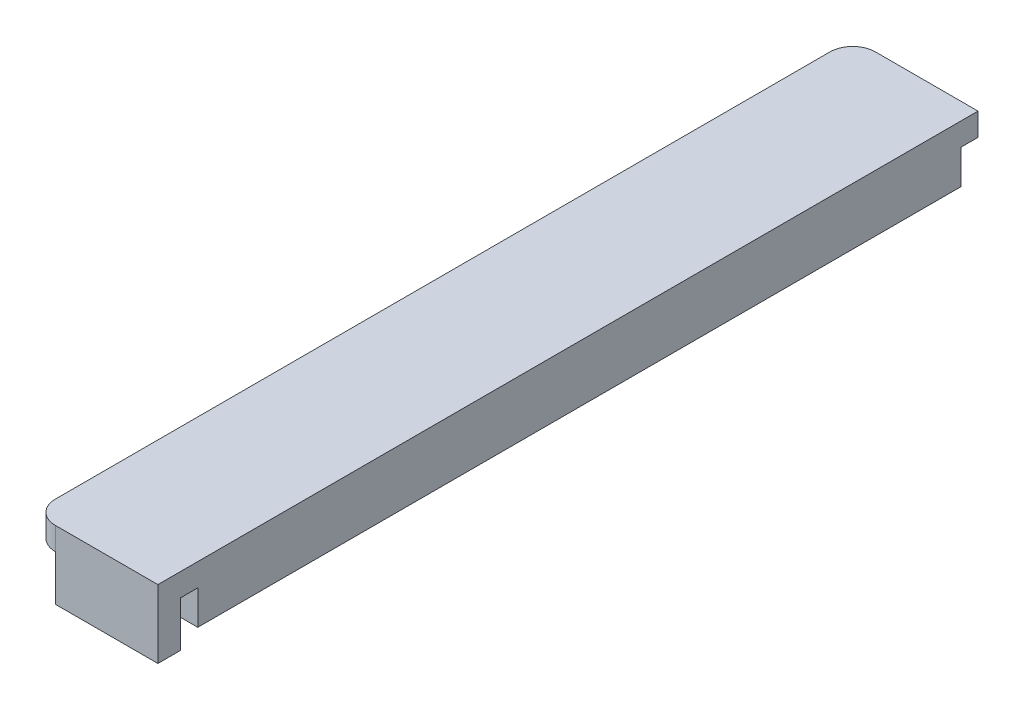
from build123d import *

# Parameters (mm, degrees)
EXTRUDE_1_DEPTH     = 2
SKETCH_2_W          = 9
SKETCH_2_H          = 2
EXTRUDE_2_DEPTH     = 4
SKETCH_3_W          = 9.5
SKETCH_3_H          = 67
EXTRUDE_3_DEPTH     = 3
SKETCH_4_W          = 16.00447387
SKETCH_4_H          = 2
CUT_EXTRUDE_1_DEPTH = 10
FILLET_1_R          = 2


with BuildPart() as part:
    # 草图1 → 凸台-拉伸1 (new body)
    with BuildSketch(Plane(origin=(0, 0, 0), x_dir=(1, 0, 0), z_dir=(0, 1, 0))):
        with BuildLine():
            Line((-3.5, 37), (5.5, 37))
            Line((5.5, 37), (5.5, -37))
            Line((5.5, -37), (-3.5, -37))
            ThreePointArc((-3.5, -37), (-4.914213562, -36.414213562), (-5.5, -35))
            Line((-5.5, -35), (-5.5, 35))
            ThreePointArc((-5.5, 35), (-4.914213562, 36.414213562), (-3.5, 37))
        make_face()
    extrude(amount=EXTRUDE_1_DEPTH)

    # 草图2 → 凸台-拉伸2 (add)
    with BuildSketch(Plane.XZ):
        with Locations((1, 36)):
            Rectangle(SKETCH_2_W, SKETCH_2_H)
        with Locations((1, -36)):
            Rectangle(SKETCH_2_W, SKETCH_2_H)
    extrude(amount=EXTRUDE_2_DEPTH)

    # 草图3 → 凸台-拉伸3 (add)
    with BuildSketch(Plane.XZ):
        with Locations((0.75, 0)):
            Rectangle(SKETCH_3_W, SKETCH_3_H)
    extrude(amount=EXTRUDE_3_DEPTH)

    # 草图4 → 切除-拉伸1 (cut)
    with BuildSketch(Plane.XZ.offset(4)):
        with Locations((-2.502236935, -36)):
            Rectangle(SKETCH_4_W, SKETCH_4_H)
    extrude(amount=-CUT_EXTRUDE_1_DEPTH, mode=Mode.SUBTRACT)

    # 圆角1
    fillet_1_edges = [part.edges().sort_by_distance(p)[0] for p in [
        (-5.5, 1, -35),
    ]]
    fillet(fillet_1_edges, radius=FILLET_1_R)


solid = part.part
